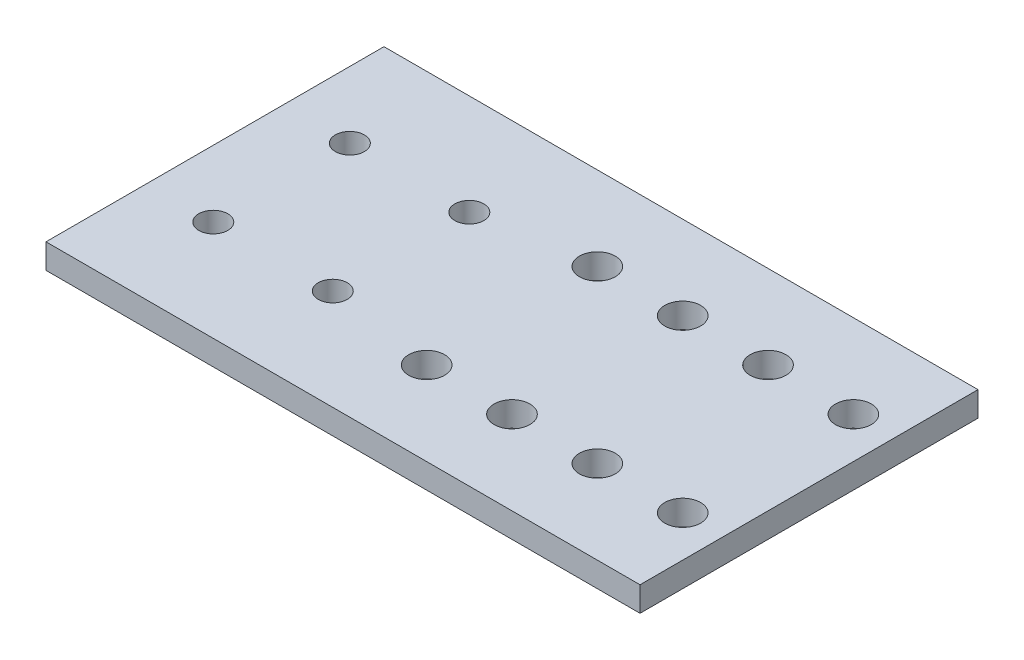
from build123d import *

# Parameters (mm, degrees)
SKETCH_1_R          = 1.7
SKETCH_1_W          = 5
SKETCH_1_H          = 13
SKETCH_1_H_2        = 2
EXTRUDE_3_DEPTH     = 2.9
SKETCH_3_R          = 2.1
CUT_EXTRUDE_3_DEPTH = 2.9
SKETCH_4_W          = 20
SKETCH_4_H          = 40
SKETCH_4_R          = 2.1
EXTRUDE_4_DEPTH     = 2.9
SKETCH_5_W          = 70
SKETCH_5_H          = 40
SKETCH_5_W_2        = 69.6
SKETCH_5_H_2        = 39.6
CUT_EXTRUDE_4_DEPTH = 2.9


with BuildPart() as part:
    # 草图1 → 凸台-拉伸3 (new body)
    # profile 1 of 10: a face of its own
    with BuildSketch(Plane(origin=(0, 0, 0), x_dir=(1, 0, 0), z_dir=(0, 1, 0))):
        with BuildLine():
            Line((-40, 113), (-70, 113))
            Line((-70, 113), (-70, 108))
            Line((-70, 108), (-70, 92))
            Line((-70, 92), (-63.7, 92))
            ThreePointArc((-63.7, 92), (-62, 93.7), (-60.3, 92))
            ThreePointArc((-60.3, 92), (-60.797918472, 90.797918472), (-62, 90.3))
            Line((-62, 90.3), (-62, 87))
            Line((-62, 87), (-48, 87))
            Line((-48, 87), (-48, 90.3))
            ThreePointArc((-48, 90.3), (-49.202081528, 93.202081528), (-46.3, 92))
            Line((-46.3, 92), (-40, 92))
            Line((-40, 92), (-40, 113))
        make_face()
        with Locations(Location((-62, 108, 0), (0, 0, 270))):
            Circle(SKETCH_1_R, mode=Mode.SUBTRACT)
        with Locations(Location((-48, 108, 0), (0, 0, 270))):
            Circle(SKETCH_1_R, mode=Mode.SUBTRACT)
    # profile 2 of 10: a face of its own
    with BuildSketch(Plane(origin=(0, 0, 0), x_dir=(1, 0, 0), z_dir=(0, 1, 0))):
        with BuildLine():
            Line((-70, 92), (-70, 87))
            Line((-70, 87), (-62, 87))
            Line((-62, 87), (-62, 90.3))
            ThreePointArc((-62, 90.3), (-63.202081528, 90.797918472), (-63.7, 92))
            Line((-63.7, 92), (-70, 92))
        make_face()
    # profile 3 of 10: a face of its own
    with BuildSketch(Plane(origin=(0, 0, 0), x_dir=(1, 0, 0), z_dir=(0, 1, 0))):
        with BuildLine():
            Line((-48, 90.3), (-48, 87))
            Line((-48, 87), (-40, 87))
            Line((-40, 87), (-40, 92))
            Line((-40, 92), (-46.3, 92))
            ThreePointArc((-46.3, 92), (-46.797918472, 90.797918472), (-48, 90.3))
        make_face()
    # profile 4 of 10: a face of its own
    with BuildSketch(Plane(origin=(0, 0, 0), x_dir=(1, 0, 0), z_dir=(0, 1, 0))):
        Polygon((-70, 87), (-70, 80), (-20, 80), (-20, 85), (-25, 85), (-25, 87), (-40, 87), (-48, 87), (-62, 87), align=None)
    # profile 5 of 10: a face of its own
    with BuildSketch(Plane(origin=(0, 0, 0), x_dir=(1, 0, 0), z_dir=(0, 1, 0))):
        Polygon((-25, 113), (-40, 113), (-40, 92), (-40, 87), (-25, 87), (-25, 100), align=None)
    # profile 6 of 10: a face of its own
    with BuildSketch(Plane(origin=(0, 0, 0), x_dir=(1, 0, 0), z_dir=(0, 1, 0))):
        with Locations((-22.5, 93.5)):
            Rectangle(SKETCH_1_W, SKETCH_1_H)
    # profile 7 of 10: a face of its own
    with BuildSketch(Plane(origin=(0, 0, 0), x_dir=(1, 0, 0), z_dir=(0, 1, 0))):
        with Locations((-22.5, 106.5)):
            Rectangle(SKETCH_1_W, SKETCH_1_H)
    # profile 8 of 10: a face of its own
    with BuildSketch(Plane(origin=(0, 0, 0), x_dir=(1, 0, 0), z_dir=(0, 1, 0))):
        with Locations((-22.5, 86)):
            Rectangle(SKETCH_1_W, SKETCH_1_H_2)
    # profile 9 of 10: a face of its own
    with BuildSketch(Plane(origin=(0, 0, 0), x_dir=(1, 0, 0), z_dir=(0, 1, 0))):
        Polygon((-20, 120), (-70, 120), (-70, 113), (-40, 113), (-25, 113), (-25, 115), (-20, 115), align=None)
    # profile 10 of 10: a face of its own
    with BuildSketch(Plane(origin=(0, 0, 0), x_dir=(1, 0, 0), z_dir=(0, 1, 0))):
        with Locations((-22.5, 114)):
            Rectangle(SKETCH_1_W, SKETCH_1_H_2)
    extrude(amount=EXTRUDE_3_DEPTH)

    # 草图3 → 切除-拉伸3 (cut)
    with BuildSketch(Plane(origin=(0, 2.9, 0), x_dir=(1, 0, 0), z_dir=(0, 1, 0))):
        with Locations(Location((-25, 110, 0), (0, 0, 270))):
            Circle(SKETCH_3_R)
        with Locations(Location((-25, 90, 0), (0, 0, 270))):
            Circle(SKETCH_3_R)
        with Locations(Location((-35, 90, 0), (0, 0, 270))):
            Circle(SKETCH_3_R)
        with Locations(Location((-35, 110, 0), (0, 0, 270))):
            Circle(SKETCH_3_R)
    extrude(amount=-CUT_EXTRUDE_3_DEPTH, mode=Mode.SUBTRACT)

    # 草图4 → 凸台-拉伸4 (add)
    with BuildSketch(Plane(origin=(0, 2.9, 0), x_dir=(1, 0, 0), z_dir=(0, 1, 0))):
        with Locations((-10, 100)):
            Rectangle(SKETCH_4_W, SKETCH_4_H)
        with Locations(Location((-15, 110, 0), (0, 0, 270))):
            Circle(SKETCH_4_R, mode=Mode.SUBTRACT)
        with Locations(Location((-15, 90, 0), (0, 0, 270))):
            Circle(SKETCH_4_R, mode=Mode.SUBTRACT)
        with Locations(Location((-5, 110, 0), (0, 0, 270))):
            Circle(SKETCH_4_R, mode=Mode.SUBTRACT)
        with Locations(Location((-5, 90, 0), (0, 0, 270))):
            Circle(SKETCH_4_R, mode=Mode.SUBTRACT)
    extrude(amount=-EXTRUDE_4_DEPTH)

    # 草图5 → 切除-拉伸4 (cut)
    with BuildSketch(Plane(origin=(0, 2.9, 0), x_dir=(1, 0, 0), z_dir=(0, 1, 0))):
        with Locations((-35, 100)):
            Rectangle(SKETCH_5_W, SKETCH_5_H)
        with Locations((-35, 100)):
            Rectangle(SKETCH_5_W_2, SKETCH_5_H_2, mode=Mode.SUBTRACT)
    extrude(amount=-CUT_EXTRUDE_4_DEPTH, mode=Mode.SUBTRACT)


solid = part.part
